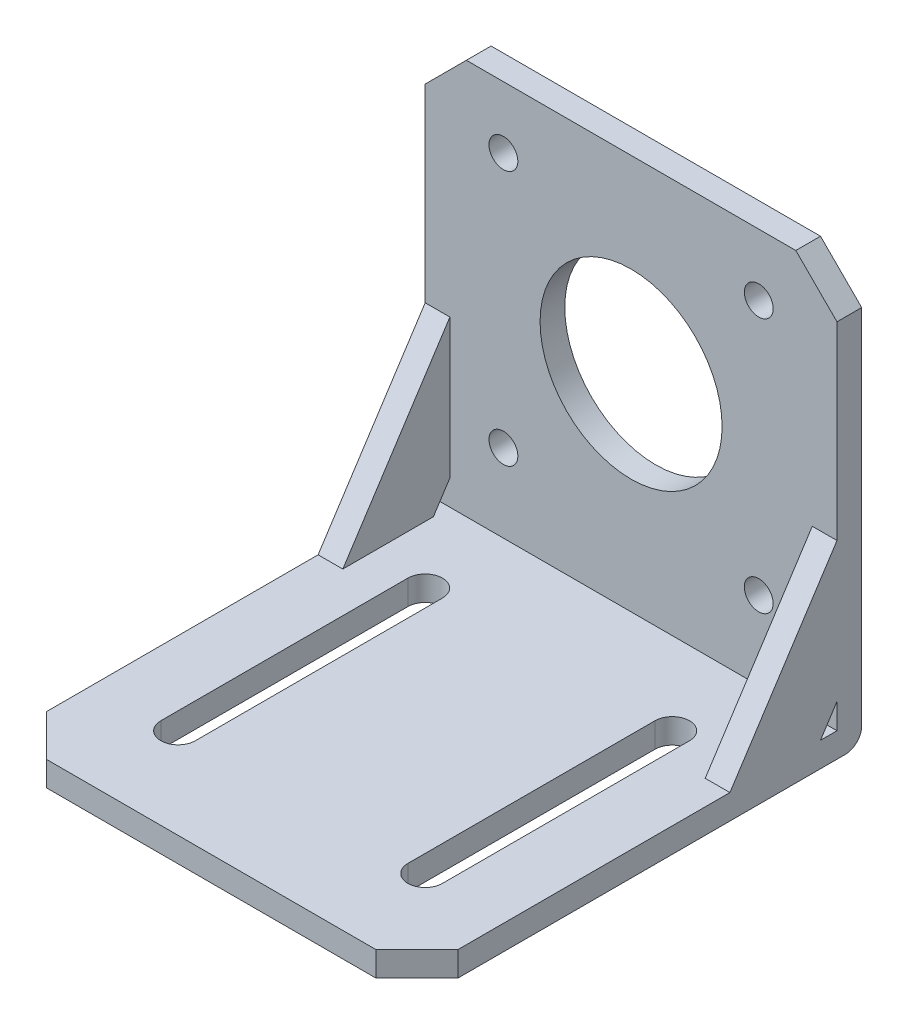
from build123d import *

# Parameters (mm, degrees)
SKETCH_1_R          = 1.75
SKETCH_1_R_2        = 11.05
EXTRUDE_1_DEPTH     = 3
SKETCH_2_W          = 50
SKETCH_2_H          = 3
EXTRUDE_2_DEPTH     = 51
FILLET_1_R          = 2
CUT_EXTRUDE_1_DEPTH = 51
CHAMFER_1_SIZE      = 5
EXTRUDE_3_DEPTH     = 3
FILLET_3_R          = 2


with BuildPart() as part:
    # 草图1 → 凸台-拉伸1 (new body)
    with BuildSketch(Plane.XY):
        Polygon((25, 29.708680022), (25, -16.291319978), (-25, -16.291319978), (-25, 29.708680022), (-20, 34.708680022), (20, 34.708680022), align=None)
        with Locations((-15.5, 27.208680022)):
            Circle(SKETCH_1_R, mode=Mode.SUBTRACT)
        with Locations((15.5, 27.208680022)):
            Circle(SKETCH_1_R, mode=Mode.SUBTRACT)
        with Locations((-15.5, -3.791319978)):
            Circle(SKETCH_1_R, mode=Mode.SUBTRACT)
        with Locations((15.5, -3.791319978)):
            Circle(SKETCH_1_R, mode=Mode.SUBTRACT)
        with Locations((0, 11.708680022)):
            Circle(SKETCH_1_R_2, mode=Mode.SUBTRACT)
    extrude_1 = extrude(amount=EXTRUDE_1_DEPTH)

    # 草图2 → 凸台-拉伸2 (add)
    with BuildSketch(Plane.XY.offset(3)):
        with Locations((0, -14.791319978)):
            Rectangle(SKETCH_2_W, SKETCH_2_H)
    extrude(amount=EXTRUDE_2_DEPTH)

    # 圆角1
    fillet_1_edges = [part.edges().sort_by_distance(p)[0] for p in [
        (0, -16.291319978, 0),
    ]]
    fillet(fillet_1_edges, radius=FILLET_1_R)

    # 草图3 → 切除-拉伸1 (cut)
    with BuildSketch(Plane(origin=(0, -13.291319978, 0), x_dir=(1, 0, 0), z_dir=(0, 1, 0))):
        with BuildLine():
            Line((-17.1, -13), (-17.1, -43))
            ThreePointArc((-17.1, -43), (-15, -45.1), (-12.9, -43))
            Line((-12.9, -43), (-12.9, -13))
            ThreePointArc((-12.9, -13), (-15, -10.9), (-17.1, -13))
        make_face()
        with BuildLine():
            Line((12.9, -13), (12.9, -43))
            ThreePointArc((12.9, -43), (15, -45.1), (17.1, -43))
            Line((17.1, -43), (17.1, -13))
            ThreePointArc((17.1, -13), (15, -10.9), (12.9, -13))
        make_face()
    extrude(amount=-CUT_EXTRUDE_1_DEPTH, mode=Mode.SUBTRACT)

    # 倒角1
    chamfer_1_edges = [part.edges().sort_by_distance(p)[0] for p in [
        (-25, -14.791319978, 54),
        (25, -14.791319978, 54),
    ]]
    chamfer(chamfer_1_edges, length=CHAMFER_1_SIZE)

    # 草图4 → 凸台-拉伸3 (add)
    with BuildSketch(Plane(origin=(25, 0, 0), x_dir=(0, 0, -1), z_dir=(1, 0, 0))):
        Polygon((-3, 6.708680022), (-16, -13.291319978), (-5, -13.291319978), (-3, -10.214396901), align=None)
    extrude_3 = extrude(amount=-EXTRUDE_3_DEPTH)

    # 镜向1: 凸台-拉伸1, 凸台-拉伸3 across plane
    add(extrude_1.mirror(Plane(origin=(0, 0, 0), x_dir=(0, 0, 1), z_dir=(1, 0, 0))))
    add(extrude_3.mirror(Plane(origin=(0, 0, 0), x_dir=(0, 0, 1), z_dir=(1, 0, 0))))

    # 圆角3
    fillet_3_edges = [part.edges().sort_by_distance(p)[0] for p in [
        (0, -16.291319978, 0),
    ]]
    fillet(fillet_3_edges, radius=FILLET_3_R)


solid = part.part
